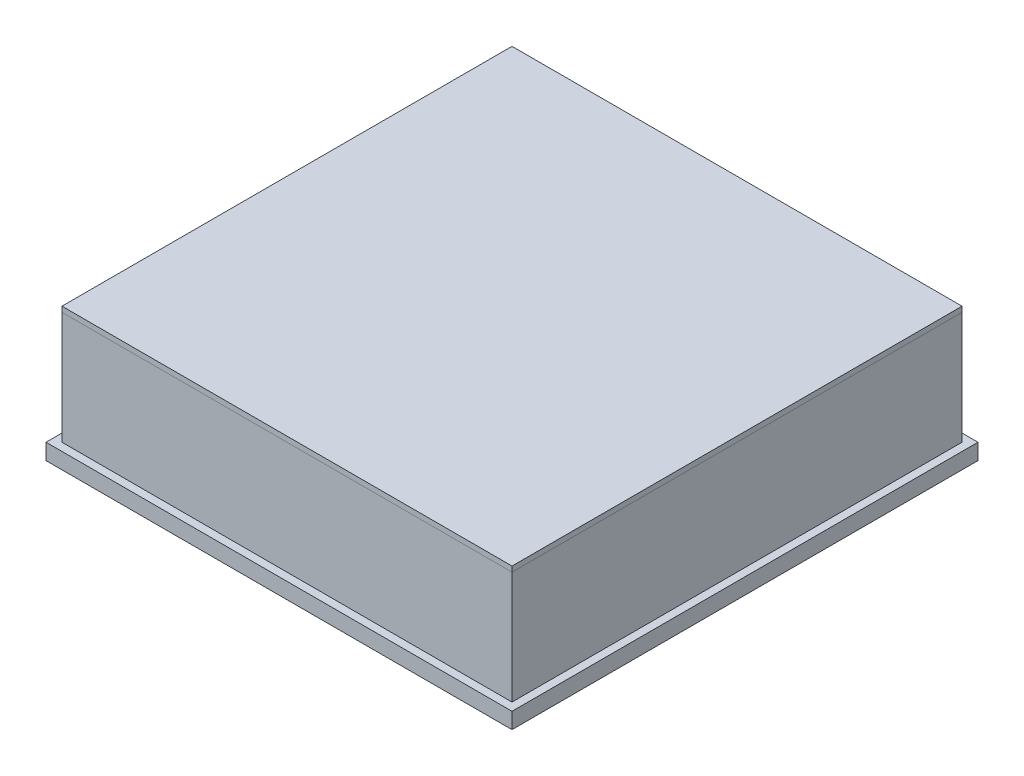
from build123d import *

# Parameters (mm, degrees)
SKETCH2_W           = 8609.584
SKETCH2_H           = 8609.584
SKETCH2_W_2         = 7999.984
SKETCH2_H_2         = 7999.984
BOSS_EXTRUDE1_DEPTH = 1999.996
SKETCH3_W           = 8609.584
SKETCH3_H           = 8609.584
BOSS_EXTRUDE2_DEPTH = 152.4
SKETCH4_W           = 8914.384
SKETCH4_H           = 8914.384
SKETCH4_W_2         = 7695.184
SKETCH4_H_2         = 7695.184
BOSS_EXTRUDE3_DEPTH = 304.8
SKETCH6_W           = 304.8
SKETCH6_H           = 304.8
BOSS_EXTRUDE5_DEPTH = 1999.996
SKETCH7_W           = 8609.584
SKETCH7_H           = 8609.584
BOSS_EXTRUDE6_DEPTH = 101.6


with BuildPart() as part:
    # Sketch2 → Boss-Extrude1 (new body)
    with BuildSketch(Plane(origin=(0, 0, 0), x_dir=(1, 0, 0), z_dir=(0, 1, 0))):
        Rectangle(SKETCH2_W, SKETCH2_H)
        Rectangle(SKETCH2_W_2, SKETCH2_H_2, mode=Mode.SUBTRACT)
    extrude(amount=BOSS_EXTRUDE1_DEPTH)

    # Sketch3 → Boss-Extrude2 (add)
    with BuildSketch(Plane.XZ):
        Rectangle(SKETCH3_W, SKETCH3_H)
    extrude(amount=BOSS_EXTRUDE2_DEPTH)

    # Sketch4 → Boss-Extrude3 (add)
    with BuildSketch(Plane.XZ.offset(152.4)):
        Rectangle(SKETCH4_W, SKETCH4_H)
        Rectangle(SKETCH4_W_2, SKETCH4_H_2, mode=Mode.SUBTRACT)
    extrude(amount=BOSS_EXTRUDE3_DEPTH)

    # Sketch6 → Boss-Extrude5 (add)
    with BuildSketch(Plane(origin=(0, 0, 0), x_dir=(1, 0, 0), z_dir=(0, 1, 0))):
        with Locations((1656.850935784, 1656.850935784)):
            Rectangle(SKETCH6_W, SKETCH6_H)
        with Locations((-1656.850935784, 1656.850935784)):
            Rectangle(SKETCH6_W, SKETCH6_H)
        with Locations((1656.850935784, -1656.850935784)):
            Rectangle(SKETCH6_W, SKETCH6_H)
        with Locations((-1656.850935784, -1656.850935784)):
            Rectangle(SKETCH6_W, SKETCH6_H)
    extrude(amount=BOSS_EXTRUDE5_DEPTH)


with BuildPart() as body_2:
    # Sketch7 → Boss-Extrude6 (new body)
    with BuildSketch(Plane(origin=(0, 1999.996, 0), x_dir=(1, 0, 0), z_dir=(0, 1, 0))):
        Rectangle(SKETCH7_W, SKETCH7_H)
    extrude(amount=BOSS_EXTRUDE6_DEPTH)


solid = Compound([part.part, body_2.part])
